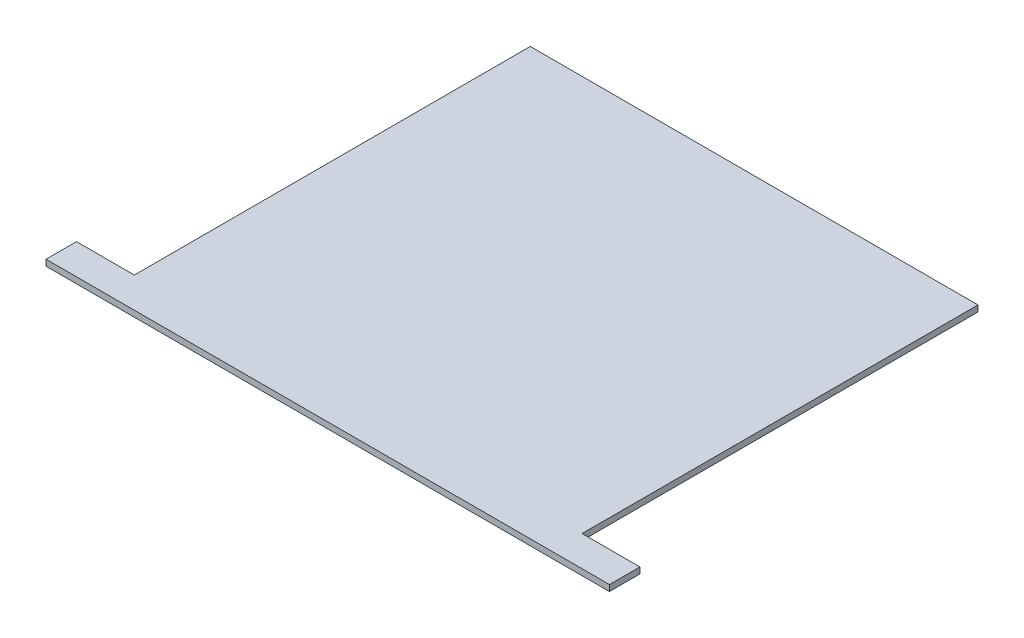
from build123d import *

# Parameters (mm, degrees)
SKETCH_1_W          = 185
SKETCH_1_H          = 140
EXTRUDE_1_DEPTH     = 2
SKETCH_3_W          = 19
SKETCH_3_H          = 130
CUT_EXTRUDE_3_DEPTH = 173.83842308
SKETCH_4_W          = 19
SKETCH_4_H          = 130
CUT_EXTRUDE_4_DEPTH = 173.83842308


with BuildPart() as part:
    # 草图1 → 凸台-拉伸1 (new body)
    with BuildSketch(Plane(origin=(0, 0, 0), x_dir=(1, 0, 0), z_dir=(0, 1, 0))):
        with Locations((38.532158624, -42.692918585)):
            Rectangle(SKETCH_1_W, SKETCH_1_H)
    extrude(amount=EXTRUDE_1_DEPTH)

    # 草图3 → 切除-拉伸3 (cut, through all)
    with BuildSketch(Plane(origin=(0, 0, 0), x_dir=(1, 0, 0), z_dir=(0, 1, 0))):
        with Locations((-44.467841376, -37.692918585)):
            Rectangle(SKETCH_3_W, SKETCH_3_H)
    extrude(amount=CUT_EXTRUDE_3_DEPTH, mode=Mode.SUBTRACT)

    # 草图4 → 切除-拉伸4 (cut, through all)
    with BuildSketch(Plane(origin=(0, 0, 0), x_dir=(1, 0, 0), z_dir=(0, 1, 0))):
        with Locations((121.532158624, -37.692918585)):
            Rectangle(SKETCH_4_W, SKETCH_4_H)
    extrude(amount=CUT_EXTRUDE_4_DEPTH, mode=Mode.SUBTRACT)


solid = part.part
